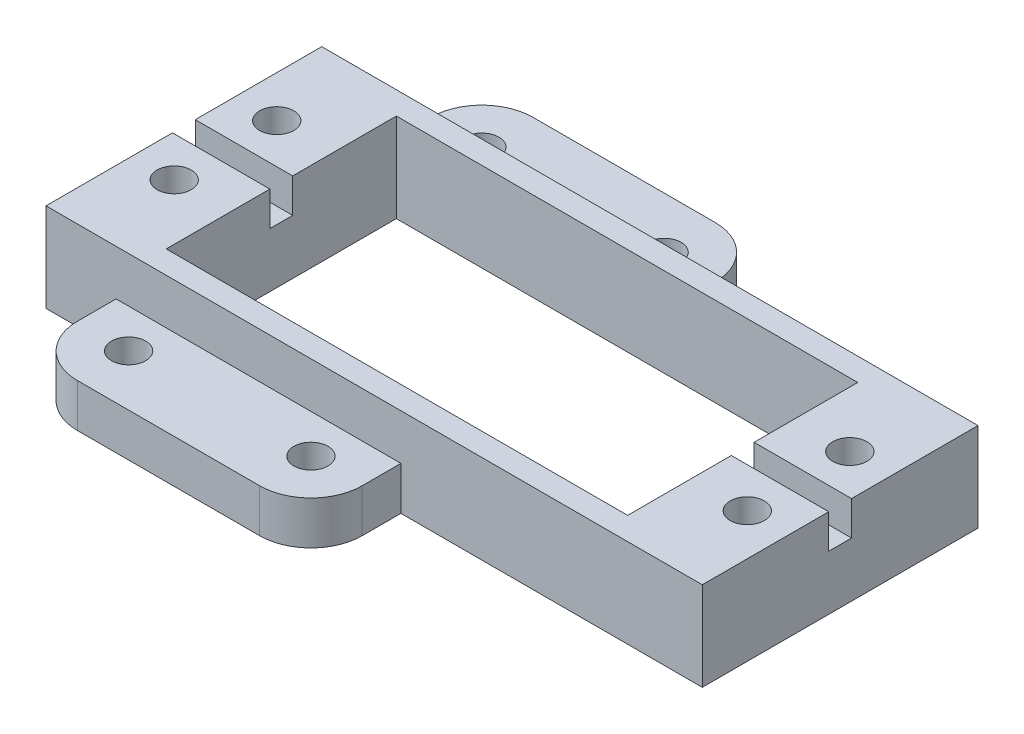
from build123d import *

# Parameters (mm, degrees)
SKETCH1_R             = 1.5
BOSS_EXTRUDE1_DEPTH   = 7.8
BOSS_EXTRUDE1_2_DEPTH = 7.8
SKETCH2_W             = 2
SKETCH2_H             = 20
BOSS_EXTRUDE2_DEPTH   = 7.8
SKETCH3_W             = 8.55
SKETCH3_H             = 0.1
BOSS_EXTRUDE3_DEPTH   = 7.8
SKETCH4_W             = 57.6
SKETCH4_H             = 2
BOSS_EXTRUDE4_DEPTH   = 7.8
SKETCH5_W             = 8.55
SKETCH5_H             = 2
CUT_EXTRUDE1_DEPTH    = 3
SKETCH6_R             = 1.5
BOSS_EXTRUDE5_DEPTH   = 7.8
SKETCH7_R             = 1.5
CUT_EXTRUDE2_DEPTH    = 4


with BuildPart() as part:
    # Sketch1 → Boss-Extrude1 (new body)
    with BuildSketch(Plane(origin=(0, 0, 0), x_dir=(1, 0, 0), z_dir=(0, 1, 0))):
        Polygon((-54.762761852, 25.466548835), (-54.762761852, 5.466548835), (-48.212761852, 5.466548835), (-48.212761852, 12.451776091), (-48.212761852, 18.48132158), (-48.212761852, 25.466548835), align=None)
        with Locations(Location((-49.862761852, 10.966548835, 0), (0, 0, 270))):
            Circle(SKETCH1_R, mode=Mode.SUBTRACT)
        with Locations(Location((-49.862761852, 19.966548835, 0), (0, 0, 270))):
            Circle(SKETCH1_R, mode=Mode.SUBTRACT)
    extrude(amount=BOSS_EXTRUDE1_DEPTH)



with BuildPart() as body_2:
    # Sketch1 → Boss-Extrude1 2 (new body)
    with BuildSketch(Plane(origin=(0, 0, 0), x_dir=(1, 0, 0), z_dir=(0, 1, 0))):
        Polygon((-101.812761852, 18.48132158), (-101.812761852, 12.451776091), (-101.812761852, 5.466548835), (-101.212761852, 5.466548835), (-95.262761852, 5.466548835), (-95.262761852, 25.466548835), (-101.812761852, 25.466548835), (-101.812761852, 24.866548835), (-101.812761852, 21.451776091), align=None)
        with Locations(Location((-100.162761852, 10.966548835, 0), (0, 0, 270))):
            Circle(SKETCH1_R, mode=Mode.SUBTRACT)
        with Locations(Location((-100.162761852, 19.966548835, 0), (0, 0, 270))):
            Circle(SKETCH1_R, mode=Mode.SUBTRACT)
    extrude(amount=BOSS_EXTRUDE1_2_DEPTH)


with BuildPart() as part_1:
    add(part.part)

    add(body_2.part)  # Boss-Extrude2 merges body 2
    # Sketch2 → Boss-Extrude2 (add)
    with BuildSketch(Plane(origin=(0, 7.8, 0), x_dir=(1, 0, 0), z_dir=(0, 1, 0))):
        with Locations((-47.212761852, 15.466548835)):
            Rectangle(SKETCH2_W, SKETCH2_H)
        with Locations((-102.812761852, 15.466548835)):
            Rectangle(SKETCH2_W, SKETCH2_H)
    extrude(amount=-BOSS_EXTRUDE2_DEPTH)

    # Sketch3 → Boss-Extrude3 (add)
    with BuildSketch(Plane(origin=(0, 7.8, 0), x_dir=(1, 0, 0), z_dir=(0, 1, 0))):
        with Locations((-99.537761852, 5.416548835)):
            Rectangle(SKETCH3_W, SKETCH3_H)
        with Locations((-99.537761852, 25.516548835)):
            Rectangle(SKETCH3_W, SKETCH3_H)
        with Locations((-50.487761852, 25.516548835)):
            Rectangle(SKETCH3_W, SKETCH3_H)
        with Locations((-50.487761852, 5.416548835)):
            Rectangle(SKETCH3_W, SKETCH3_H)
    extrude(amount=-BOSS_EXTRUDE3_DEPTH)

    # Sketch4 → Boss-Extrude4 (add)
    with BuildSketch(Plane(origin=(0, 7.8, 0), x_dir=(1, 0, 0), z_dir=(0, 1, 0))):
        with Locations((-75.012761852, 26.566548835)):
            Rectangle(SKETCH4_W, SKETCH4_H)
        with Locations((-75.012761852, 4.366548835)):
            Rectangle(SKETCH4_W, SKETCH4_H)
    extrude(amount=-BOSS_EXTRUDE4_DEPTH)

    # Sketch5 → Cut-Extrude1 (cut)
    with BuildSketch(Plane(origin=(0, 7.8, 0), x_dir=(1, 0, 0), z_dir=(0, 1, 0))):
        with Locations((-99.537761852, 15.466548835)):
            Rectangle(SKETCH5_W, SKETCH5_H)
        with Locations((-50.487761852, 15.466548835)):
            Rectangle(SKETCH5_W, SKETCH5_H)
    extrude(amount=-CUT_EXTRUDE1_DEPTH, mode=Mode.SUBTRACT)

    # Sketch6 → Boss-Extrude5 (add)
    # profile 1 of 10: a face of its own
    with BuildSketch(Plane(origin=(0, 7.8, 0), x_dir=(1, 0, 0), z_dir=(0, 1, 0))):
        with BuildLine():
            Line((-97.660965944, 3.366548835), (-97.660965944, -0.033392238))
            ThreePointArc((-97.660965944, -0.033392238), (-97.254605431, 1.835328112), (-96.108914501, 3.366548835))
            Line((-96.108914501, 3.366548835), (-97.660965944, 3.366548835))
        make_face()
    # profile 2 of 10: a face of its own
    with BuildSketch(Plane(origin=(0, 7.8, 0), x_dir=(1, 0, 0), z_dir=(0, 1, 0))):
        with BuildLine():
            ThreePointArc((-96.108914501, 3.366548835), (-97.254605431, 1.835328112), (-97.660965944, -0.033392238))
            ThreePointArc((-97.660965944, -0.033392238), (-96.342946459, -3.215372753), (-93.160965944, -4.533392238))
            ThreePointArc((-93.160965944, -4.533392238), (-89.978985428, -3.215372753), (-88.660965944, -0.033392238))
            ThreePointArc((-88.660965944, -0.033392238), (-89.067326456, 1.835328112), (-90.213017386, 3.366548835))
            Line((-90.213017386, 3.366548835), (-96.108914501, 3.366548835))
        make_face()
        with Locations(Location((-93.160965944, -0.033392238, 0), (0, 0, 270))):
            Circle(SKETCH6_R, mode=Mode.SUBTRACT)
    # profile 3 of 10: a face of its own
    with BuildSketch(Plane(origin=(0, 7.8, 0), x_dir=(1, 0, 0), z_dir=(0, 1, 0))):
        with BuildLine():
            ThreePointArc((-88.660965944, -0.033392238), (-89.978985428, -3.215372753), (-93.160965944, -4.533392238))
            Line((-93.160965944, -4.533392238), (-77.160965417, -4.533392238))
            ThreePointArc((-77.160965417, -4.533392238), (-81.376990489, -1.606647648), (-80.108913974, 3.366548835))
            Line((-80.108913974, 3.366548835), (-90.213017386, 3.366548835))
            ThreePointArc((-90.213017386, 3.366548835), (-89.067326456, 1.835328112), (-88.660965944, -0.033392238))
        make_face()
    # profile 4 of 10: a face of its own
    with BuildSketch(Plane(origin=(0, 7.8, 0), x_dir=(1, 0, 0), z_dir=(0, 1, 0))):
        with BuildLine():
            ThreePointArc((-80.108913974, 3.366548835), (-81.376990489, -1.606647648), (-77.160965417, -4.533392238))
            ThreePointArc((-77.160965417, -4.533392238), (-73.978984901, -3.215372753), (-72.660965417, -0.033392238))
            ThreePointArc((-72.660965417, -0.033392238), (-73.067325929, 1.835328112), (-74.213016859, 3.366548835))
            Line((-74.213016859, 3.366548835), (-80.108913974, 3.366548835))
        make_face()
        with Locations(Location((-77.160965417, -0.033392238, 0), (0, 0, 270))):
            Circle(SKETCH6_R, mode=Mode.SUBTRACT)
    # profile 5 of 10: a face of its own
    with BuildSketch(Plane(origin=(0, 7.8, 0), x_dir=(1, 0, 0), z_dir=(0, 1, 0))):
        with BuildLine():
            ThreePointArc((-74.213016859, 3.366548835), (-73.067325929, 1.835328112), (-72.660965417, -0.033392238))
            Line((-72.660965417, -0.033392238), (-72.660965417, 3.366548835))
            Line((-72.660965417, 3.366548835), (-74.213016859, 3.366548835))
        make_face()
    # profile 6 of 10: a face of its own
    with BuildSketch(Plane(origin=(0, 7.8, 0), x_dir=(1, 0, 0), z_dir=(0, 1, 0))):
        with BuildLine():
            ThreePointArc((-72.660965417, 30.966605859), (-73.978984901, 34.148586374), (-77.160965417, 35.466605859))
            ThreePointArc((-77.160965417, 35.466605859), (-81.377021429, 32.539778353), (-80.108780241, 27.566548835))
            Line((-80.108780241, 27.566548835), (-74.213150592, 27.566548835))
            ThreePointArc((-74.213150592, 27.566548835), (-73.067362681, 29.097805001), (-72.660965417, 30.966605859))
        make_face()
        with Locations(Location((-77.160965417, 30.966605859, 0), (0, 0, 270))):
            Circle(SKETCH6_R, mode=Mode.SUBTRACT)
    # profile 7 of 10: a face of its own
    with BuildSketch(Plane(origin=(0, 7.8, 0), x_dir=(1, 0, 0), z_dir=(0, 1, 0))):
        with BuildLine():
            Line((-74.213150592, 27.566548835), (-72.660965417, 27.566548835))
            Line((-72.660965417, 27.566548835), (-72.660965417, 30.966605859))
            ThreePointArc((-72.660965417, 30.966605859), (-73.067362681, 29.097805001), (-74.213150592, 27.566548835))
        make_face()
    # profile 8 of 10: a face of its own
    with BuildSketch(Plane(origin=(0, 7.8, 0), x_dir=(1, 0, 0), z_dir=(0, 1, 0))):
        with BuildLine():
            Line((-77.160965417, 35.466605859), (-93.160965944, 35.466605859))
            ThreePointArc((-93.160965944, 35.466605859), (-89.978985428, 34.148586374), (-88.660965944, 30.966605859))
            ThreePointArc((-88.660965944, 30.966605859), (-89.067363208, 29.097805001), (-90.213151119, 27.566548835))
            Line((-90.213151119, 27.566548835), (-80.108780241, 27.566548835))
            ThreePointArc((-80.108780241, 27.566548835), (-81.377021429, 32.539778353), (-77.160965417, 35.466605859))
        make_face()
    # profile 9 of 10: a face of its own
    with BuildSketch(Plane(origin=(0, 7.8, 0), x_dir=(1, 0, 0), z_dir=(0, 1, 0))):
        with BuildLine():
            ThreePointArc((-93.160965944, 35.466605859), (-96.342946459, 34.148586374), (-97.660965944, 30.966605859))
            ThreePointArc((-97.660965944, 30.966605859), (-97.254568679, 29.097805001), (-96.108780768, 27.566548835))
            Line((-96.108780768, 27.566548835), (-90.213151119, 27.566548835))
            ThreePointArc((-90.213151119, 27.566548835), (-89.067363208, 29.097805001), (-88.660965944, 30.966605859))
            ThreePointArc((-88.660965944, 30.966605859), (-89.978985428, 34.148586374), (-93.160965944, 35.466605859))
        make_face()
        with Locations(Location((-93.160965944, 30.966605859, 0), (0, 0, 270))):
            Circle(SKETCH6_R, mode=Mode.SUBTRACT)
    # profile 10 of 10: a face of its own
    with BuildSketch(Plane(origin=(0, 7.8, 0), x_dir=(1, 0, 0), z_dir=(0, 1, 0))):
        with BuildLine():
            Line((-97.660965944, 30.966605859), (-97.660965944, 27.566548835))
            Line((-97.660965944, 27.566548835), (-96.108780768, 27.566548835))
            ThreePointArc((-96.108780768, 27.566548835), (-97.254568679, 29.097805001), (-97.660965944, 30.966605859))
        make_face()
    extrude(amount=-BOSS_EXTRUDE5_DEPTH)

    # Sketch7 → Cut-Extrude2 (cut)
    # profile 1 of 2: a face of its own
    with BuildSketch(Plane(origin=(0, 7.8, 0), x_dir=(1, 0, 0), z_dir=(0, 1, 0))):
        with BuildLine():
            Line((-97.660965944, 3.366548835), (-72.660965417, 3.366548835))
            Line((-72.660965417, 3.366548835), (-72.660965417, -0.033392238))
            ThreePointArc((-72.660965417, -0.033392238), (-73.978984901, -3.215372753), (-77.160965417, -4.533392238))
            Line((-77.160965417, -4.533392238), (-93.160965944, -4.533392238))
            ThreePointArc((-93.160965944, -4.533392238), (-96.342946459, -3.215372753), (-97.660965944, -0.033392238))
            Line((-97.660965944, -0.033392238), (-97.660965944, 3.366548835))
        make_face()
        with Locations(Location((-77.160965417, -0.033392238, 0), (0, 0, 270))):
            Circle(SKETCH7_R, mode=Mode.SUBTRACT)
        with Locations(Location((-93.160965944, -0.033392238, 0), (0, 0, 270))):
            Circle(SKETCH7_R, mode=Mode.SUBTRACT)
    # profile 2 of 2: a face of its own
    with BuildSketch(Plane(origin=(0, 7.8, 0), x_dir=(1, 0, 0), z_dir=(0, 1, 0))):
        with BuildLine():
            Line((-77.160965417, 35.466605859), (-93.160965944, 35.466605859))
            ThreePointArc((-93.160965944, 35.466605859), (-96.342946459, 34.148586374), (-97.660965944, 30.966605859))
            Line((-97.660965944, 30.966605859), (-97.660965944, 27.566548835))
            Line((-97.660965944, 27.566548835), (-72.660965417, 27.566548835))
            Line((-72.660965417, 27.566548835), (-72.660965417, 30.966605859))
            ThreePointArc((-72.660965417, 30.966605859), (-73.978984901, 34.148586374), (-77.160965417, 35.466605859))
        make_face()
    extrude(amount=-CUT_EXTRUDE2_DEPTH, mode=Mode.SUBTRACT)


solid = part_1.part
